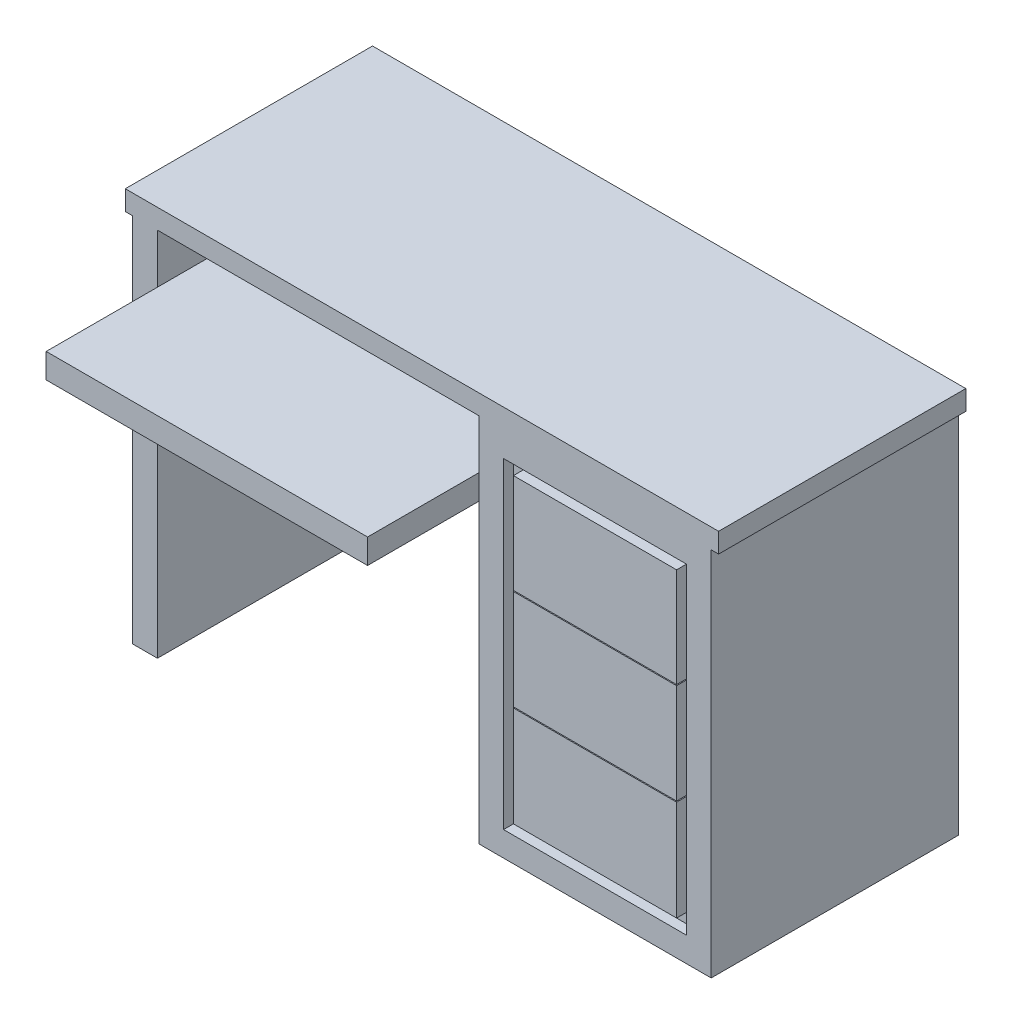
from build123d import *

# Parameters (mm, degrees)
SKETCH1_W               = 1200
SKETCH1_H               = 500
BOSS_EXTRUDE1_DEPTH     = 40
SKETCH2_W               = 50
SKETCH2_H               = 500
BOSS_EXTRUDE2_DEPTH     = 750
SKETCH3_W               = 650
SKETCH3_H               = 50
BOSS_EXTRUDE3_DEPTH     = 225
SKETCH4_W               = 50
SKETCH4_H               = 500
BOSS_EXTRUDE4_DEPTH     = 750
SKETCH5_W               = 370
SKETCH5_H               = 50
BOSS_EXTRUDE5_DEPTH     = 500
SKETCH6_W               = 370
SKETCH6_H               = 650
BOSS_EXTRUDE6_DEPTH     = 50
SKETCH7_W               = 330
SKETCH7_H               = 610
BOSS_EXTRUDE7_DEPTH     = 450
SKETCH13_W              = 370
SKETCH13_H              = 650
SKETCH13_W_2            = 330
SKETCH13_H_2            = 610
BOSS_EXTRUDE9_DEPTH     = 450
SKETCH13_3_W            = 370
SKETCH13_3_H            = 650
SKETCH13_3_W_2          = 330
SKETCH13_3_H_2          = 610
CUT_EXTRUDE1_DEPTH      = 20
SKETCH14_W              = 330
SKETCH14_H              = 2
CUT_EXTRUDE_THIN1_DEPTH = 450


with BuildPart() as part:
    # Sketch1 → Boss-Extrude1 (new body)
    with BuildSketch(Plane(origin=(0, 0, 0), x_dir=(1, 0, 0), z_dir=(0, 1, 0))):
        with Locations((600, 250)):
            Rectangle(SKETCH1_W, SKETCH1_H)
    extrude(amount=BOSS_EXTRUDE1_DEPTH)

    # Sketch2 → Boss-Extrude2 (add)
    with BuildSketch(Plane.XZ):
        with Locations((40, -250)):
            Rectangle(SKETCH2_W, SKETCH2_H)
        with Locations((1160, -250)):
            Rectangle(SKETCH2_W, SKETCH2_H)
    extrude(amount=BOSS_EXTRUDE2_DEPTH)

    # Sketch3 → Boss-Extrude3 (add, symmetric)
    with BuildSketch(Plane.XY):
        with Locations((390, -125)):
            Rectangle(SKETCH3_W, SKETCH3_H)
    extrude(amount=BOSS_EXTRUDE3_DEPTH, both=True)

    # Sketch4 → Boss-Extrude4 (add)
    with BuildSketch(Plane.XZ):
        with Locations((740, -250)):
            Rectangle(SKETCH4_W, SKETCH4_H)
    extrude(amount=BOSS_EXTRUDE4_DEPTH)

    # Sketch5 → Boss-Extrude5 (add)
    with BuildSketch(Plane.XY):
        with Locations((950, -25)):
            Rectangle(SKETCH5_W, SKETCH5_H)
        with Locations((950, -725)):
            Rectangle(SKETCH5_W, SKETCH5_H)
    extrude(amount=-BOSS_EXTRUDE5_DEPTH)

    # Sketch6 → Boss-Extrude6 (add)
    with BuildSketch(Plane(origin=(0, 0, -500), x_dir=(-1, 0, 0), z_dir=(0, 0, -1))):
        with Locations((-950, -375)):
            Rectangle(SKETCH6_W, SKETCH6_H)
    extrude(amount=-BOSS_EXTRUDE6_DEPTH)

    # Sketch7 → Boss-Extrude7 (add)
    with BuildSketch(Plane.XY):
        with Locations((950, -375)):
            Rectangle(SKETCH7_W, SKETCH7_H)
    extrude(amount=-BOSS_EXTRUDE7_DEPTH)

    # Sketch13 → Boss-Extrude9 (add)
    with BuildSketch(Plane.XY):
        with Locations((950, -375)):
            Rectangle(SKETCH13_W, SKETCH13_H)
        with Locations((950, -375)):
            Rectangle(SKETCH13_W_2, SKETCH13_H_2, mode=Mode.SUBTRACT)
    extrude(amount=-BOSS_EXTRUDE9_DEPTH)

    # Sketch13<3> → Cut-Extrude1 (cut)
    with BuildSketch(Plane.XY):
        with Locations((950, -375)):
            Rectangle(SKETCH13_3_W, SKETCH13_3_H)
        with Locations((950, -375)):
            Rectangle(SKETCH13_3_W_2, SKETCH13_3_H_2, mode=Mode.SUBTRACT)
    extrude(amount=-CUT_EXTRUDE1_DEPTH, mode=Mode.SUBTRACT)

    # Sketch14 → Cut-Extrude-Thin1 (cut)
    with BuildSketch(Plane.XY):
        with Locations((950, -272)):
            Rectangle(SKETCH14_W, SKETCH14_H)
        with Locations((950, -476)):
            Rectangle(SKETCH14_W, SKETCH14_H)
    extrude(amount=-CUT_EXTRUDE_THIN1_DEPTH, mode=Mode.SUBTRACT)


solid = part.part
